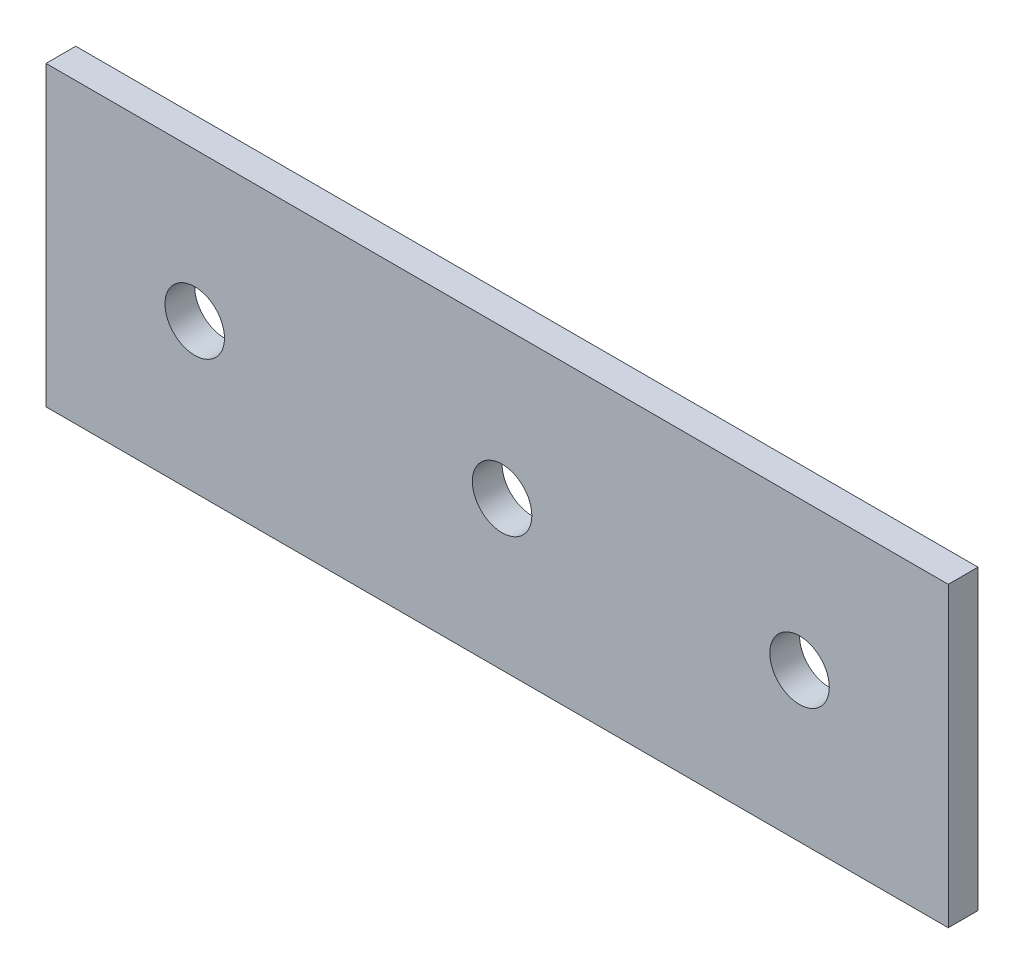
from build123d import *

# Parameters (mm, degrees)
ESQUISSE1_W      = 45.5
ESQUISSE1_H      = 15
ESQUISSE1_R      = 1.5
EXTRUSION1_DEPTH = 1.5


with BuildPart() as part:
    # Esquisse1 → Extrusion1 (new body)
    with BuildSketch(Plane.XY):
        with Locations((-13.317265327, 7.499368421)):
            Rectangle(ESQUISSE1_W, ESQUISSE1_H)
        with Locations((-28.567265327, 7.499368421)):
            Circle(ESQUISSE1_R, mode=Mode.SUBTRACT)
        with Locations((1.932734673, 7.499368421)):
            Circle(ESQUISSE1_R, mode=Mode.SUBTRACT)
        with Locations((-13.067265327, 7.499368421)):
            Circle(ESQUISSE1_R, mode=Mode.SUBTRACT)
    extrude(amount=EXTRUSION1_DEPTH)


solid = part.part
